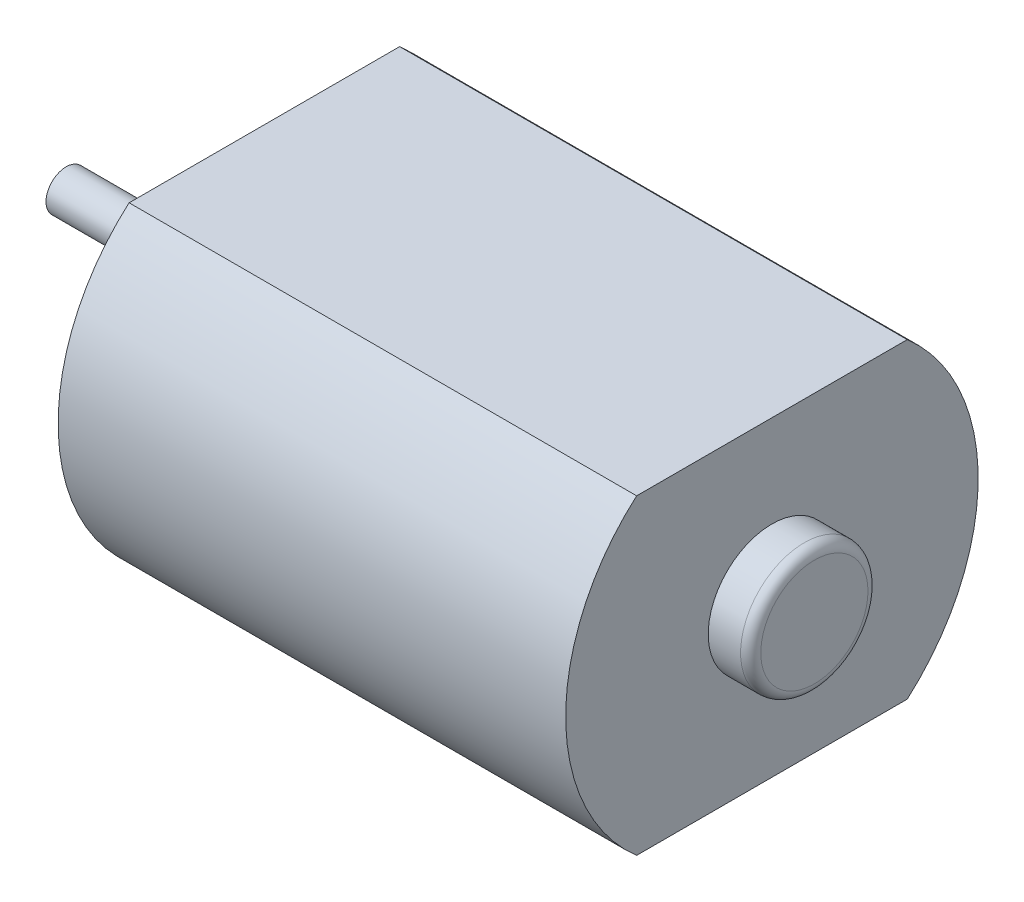
from build123d import *

# Parameters (mm, degrees)
SKETCH_1_R           = 10.2
EXTRUDE_1_DEPTH      = 25.1
SKETCH_2_OUTSIDE_W   = 30.048
SKETCH_2_OUTSIDE_H   = 30.048
SKETCH_2_OUTSIDE_W_2 = 29.995014986
SKETCH_2_OUTSIDE_H_2 = 15.4
CUT_EXTRUDE_1_DEPTH  = 54.1
SKETCH_3_R           = 3.15
EXTRUDE_2_DEPTH      = 2.1
FILLET_1_R           = 0.5
SKETCH_4_R           = 3.075
EXTRUDE_3_DEPTH      = 1.7
SKETCH_6_R           = 1
EXTRUDE_4_DEPTH      = 9.8
SKETCH_7_R           = 1.1
CUT_EXTRUDE_2_DEPTH  = 3


with BuildPart() as part:
    # 草图1 → 凸台-拉伸1 (new body)
    with BuildSketch(Plane(origin=(0, 0, 0), x_dir=(0, 0, -1), z_dir=(1, 0, 0))):
        Circle(SKETCH_1_R)
    extrude(amount=EXTRUDE_1_DEPTH)

    # 草图2 outside → 切除-拉伸1 (cut)
    with BuildSketch(Plane.ZY):
        Rectangle(SKETCH_2_OUTSIDE_W, SKETCH_2_OUTSIDE_H)
        Rectangle(SKETCH_2_OUTSIDE_W_2, SKETCH_2_OUTSIDE_H_2, mode=Mode.SUBTRACT)
    extrude(amount=-CUT_EXTRUDE_1_DEPTH, mode=Mode.SUBTRACT)

    # 草图3 → 凸台-拉伸2 (add)
    with BuildSketch(Plane(origin=(25.1, 0, 0), x_dir=(0, 0, -1), z_dir=(1, 0, 0))):
        Circle(SKETCH_3_R)
    extrude(amount=EXTRUDE_2_DEPTH)

    # 圆角1
    fillet_1_edges = [part.edges().sort_by_distance(p)[0] for p in [
        (27.2, 0, 3.15),
    ]]
    fillet(fillet_1_edges, radius=FILLET_1_R)

    # 草图4 → 凸台-拉伸3 (add)
    with BuildSketch(Plane.ZY):
        Circle(SKETCH_4_R)
    extrude(amount=EXTRUDE_3_DEPTH)

    # 草图6 → 凸台-拉伸4 (add)
    with BuildSketch(Plane.ZY):
        Circle(SKETCH_6_R)
    extrude(amount=EXTRUDE_4_DEPTH)

    # 草图7 → 切除-拉伸2 (cut)
    with BuildSketch(Plane.ZY):
        with Locations((6.2, 0)):
            Circle(SKETCH_7_R)
        with Locations((-6.2, 0)):
            Circle(SKETCH_7_R)
    extrude(amount=-CUT_EXTRUDE_2_DEPTH, mode=Mode.SUBTRACT)


solid = part.part
